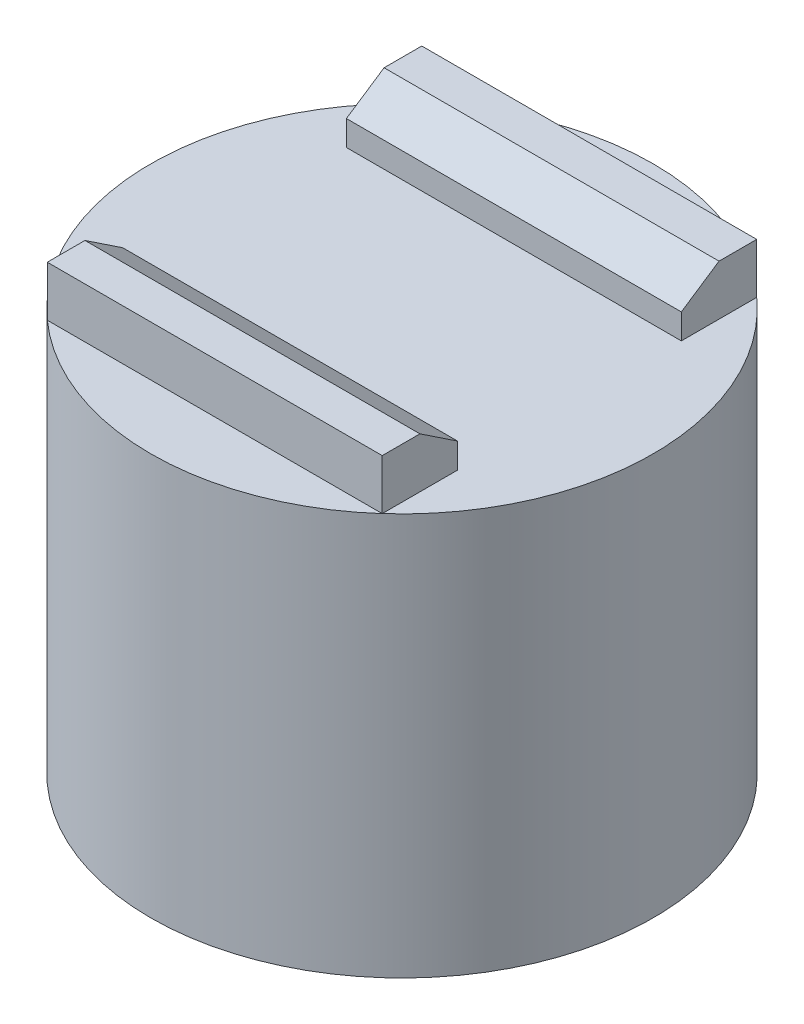
from build123d import *

# Parameters (mm, degrees)
SKETCH1_R           = 15
BOSS_EXTRUDE1_DEPTH = 24
SKETCH2_W           = 20
SKETCH2_H           = 4.5
BOSS_EXTRUDE2_DEPTH = 3
CUT_EXTRUDE1_DEPTH  = 43
SKETCH4_R           = 2.5
CUT_EXTRUDE2_DEPTH  = 7


with BuildPart() as part:
    # Sketch1 → Boss-Extrude1 (new body)
    with BuildSketch(Plane(origin=(0, 0, 0), x_dir=(1, 0, 0), z_dir=(0, 1, 0))):
        with Locations(Location((0, 0, 0), (0, 0, 270))):
            Circle(SKETCH1_R)
    extrude(amount=BOSS_EXTRUDE1_DEPTH)

    # Sketch2 → Boss-Extrude2 (add)
    with BuildSketch(Plane(origin=(0, 24, 0), x_dir=(1, 0, 0), z_dir=(0, 1, 0))):
        with Locations((0, 8.930339887)):
            Rectangle(SKETCH2_W, SKETCH2_H)
    extrude(amount=BOSS_EXTRUDE2_DEPTH)

    # Sketch3 → Cut-Extrude1 (cut)
    with BuildSketch(Plane(origin=(10, 0, 0), x_dir=(0, 0, -1), z_dir=(1, 0, 0))):
        Polygon((6.680339887, 25.5), (8.930339887, 27), (6.680339887, 27), align=None)
    extrude(amount=-CUT_EXTRUDE1_DEPTH, mode=Mode.SUBTRACT)

    # Mirror1: part across plane


with BuildPart() as part_1:
    add(part.part)
    add(part.part.mirror(Plane.XY))

    # Sketch4 → Cut-Extrude2 (cut)
    with BuildSketch(Plane.XZ):
        with Locations(Location((0, 0, 0), (0, 0, 270))):
            Circle(SKETCH4_R)
    extrude(amount=-CUT_EXTRUDE2_DEPTH, mode=Mode.SUBTRACT)


solid = part_1.part
